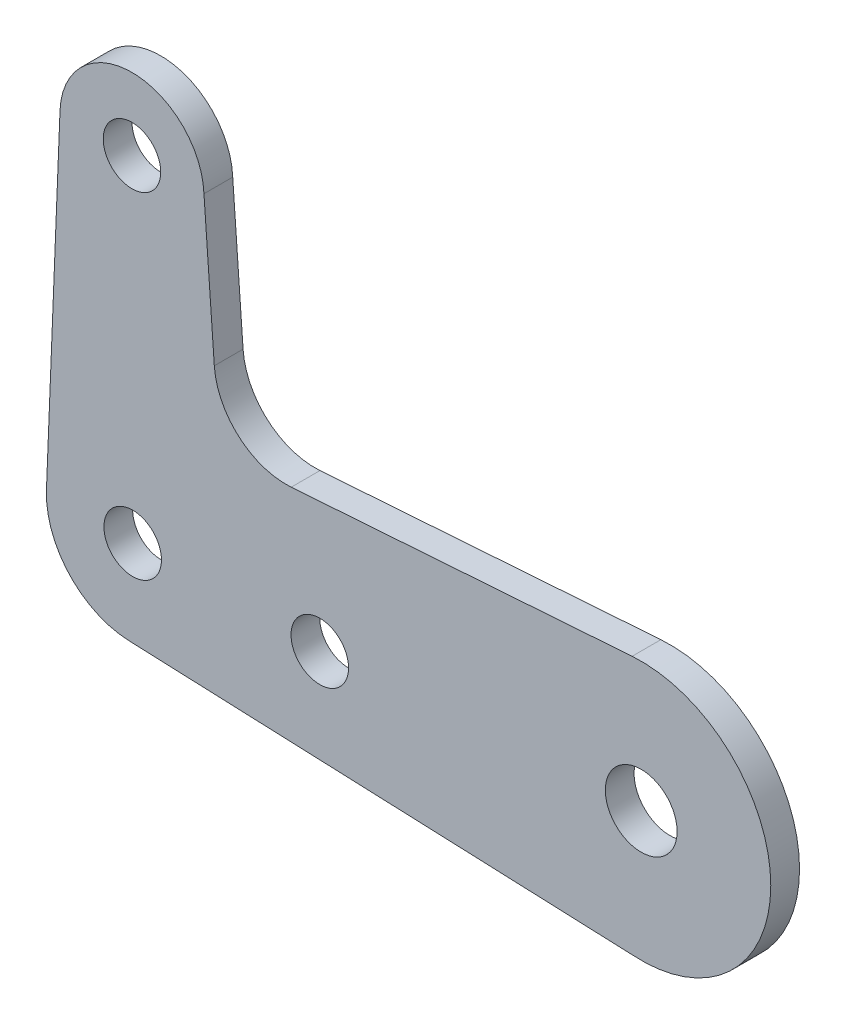
from build123d import *

# Parameters (mm, degrees)
BOSS_EXTRUDE1_DEPTH = 3.175
SKETCH2_R           = 3.175
SKETCH2_R_2         = 3.9624
CUT_EXTRUDE1_DEPTH  = 81.028865201


with BuildPart() as part:
    # Sketch1 → Boss-Extrude1 (new body)
    with BuildSketch(Plane.XY):
        with BuildLine():
            Line((-8.59782659, 31.301462428), (-10.093511639, -5.663325214))
            ThreePointArc((-10.093511639, -5.663325214), (-7.578284086, -12.505800719), (-0.961388798, -15.56562709))
            Line((-0.961388798, -15.56562709), (54.545398844, -17.811566474))
            ThreePointArc((54.545398844, -17.811566474), (69.849659789, -3.546659126), (54.545398844, 10.718248223))
            Line((54.545398844, 10.718248223), (16.920374135, 8.069943754))
            ThreePointArc((16.920374135, 8.069943754), (11.153958802, 9.993838528), (8.432498518, 15.429514275))
            Line((8.432498518, 15.429514275), (7.28957324, 31.301462428))
            ThreePointArc((7.28957324, 31.301462428), (-0.654126675, 38.930241044), (-8.59782659, 31.301462428))
        make_face()
    extrude(amount=BOSS_EXTRUDE1_DEPTH)

    # Sketch2 → Cut-Extrude1 (cut, through all)
    with BuildSketch(Plane.XY.offset(3.175)):
        with Locations((-0.654126675, 30.980041044)):
            Circle(SKETCH2_R)
        with Locations((-0.576299281, -6.048414732)):
            Circle(SKETCH2_R)
        with Locations((20.073900719, -6.048414732)):
            Circle(SKETCH2_R)
        with Locations((55.549459789, -3.546659126)):
            Circle(SKETCH2_R_2)
    extrude(amount=-CUT_EXTRUDE1_DEPTH, mode=Mode.SUBTRACT)


solid = part.part
